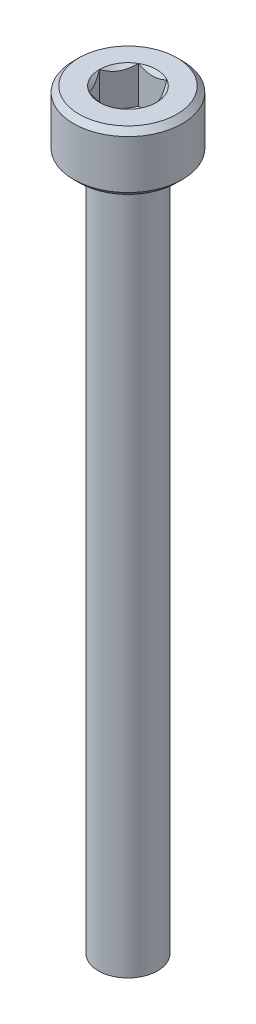
from build123d import *

# Parameters (mm, degrees)
SKETCH1_R           = 2.75
BOSS_EXTRUDE1_DEPTH = 3
CUT_EXTRUDE1_DEPTH  = 1.88
CHAMFER1_SIZE       = 0.275
SKETCH_1_R          = 1.5
EXTRUDE_1_DEPTH     = 35


with BuildPart() as part:
    # Sketch1 → Boss-Extrude1 (new body)
    with BuildSketch(Plane(origin=(0, 0, 0), x_dir=(1, 0, 0), z_dir=(0, 1, 0))):
        with Locations(Location((0, 0, 0), (0, 0, 270))):
            Circle(SKETCH1_R)
    extrude(amount=BOSS_EXTRUDE1_DEPTH)

    # Sketch2 → Cut-Extrude1 (cut)
    with BuildSketch(Plane(origin=(0, 3, 0), x_dir=(1, 0, 0), z_dir=(0, 1, 0))):
        Polygon((0.721687836, 1.25), (-0.721687836, 1.25), (-1.443375673, 0), (-0.721687836, -1.25), (0.721687836, -1.25), (1.443375673, 0), align=None)
    extrude(amount=-CUT_EXTRUDE1_DEPTH, mode=Mode.SUBTRACT)

    # Cut-Extrude2 cone 1 section (through the dimple's axis) → Cut-Extrude2 (revolve, cut)
    with BuildSketch(Plane(origin=(0, 3, 0), x_dir=(0, 0, 1), z_dir=(1, 0, 0))):
        Polygon((0, 0), (1.443375673, 0), (0, 1.443375673), align=None)
    revolve(axis=Axis((0, 3, 0), (0, -1, 0)), mode=Mode.SUBTRACT)

    # Chamfer1
    chamfer1_edges = [part.edges().sort_by_distance(p)[0] for p in [
        (0, 0, -2.75),
        (0, 3, -2.75),
    ]]
    chamfer(chamfer1_edges, length=CHAMFER1_SIZE)

    # 草图1 → 凸台-拉伸1 (add)
    with BuildSketch(Plane(origin=(0, 0, 0), x_dir=(-1, 0, 0), z_dir=(0, -1, 0))):
        with Locations(Location((0, 0, 0), (0, 0, 90))):
            Circle(SKETCH_1_R)
    extrude(amount=EXTRUDE_1_DEPTH)


solid = part.part
